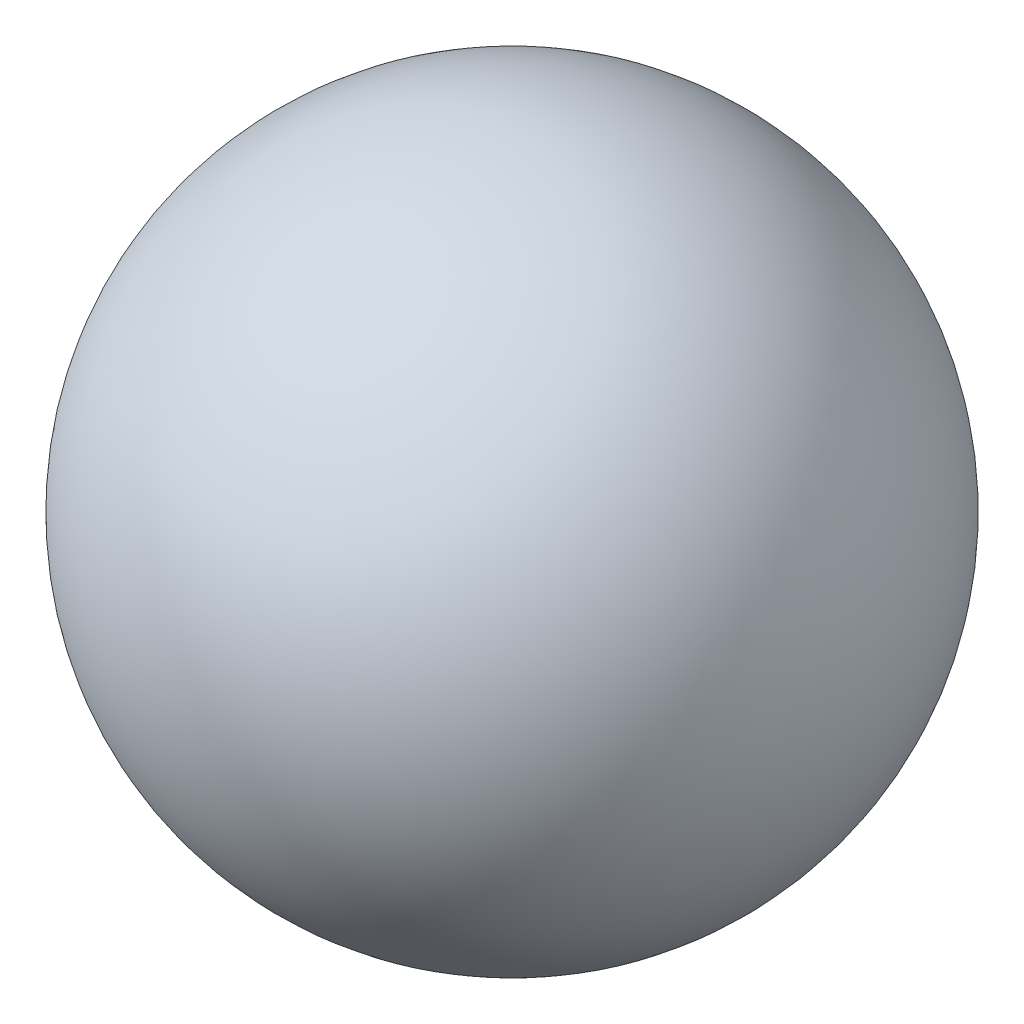
from build123d import *


with BuildPart() as part:
    # Sketch1 → Revolve1 (revolve)
    with BuildSketch(Plane.XY):
        with BuildLine():
            Line((0, 215.9), (0, 0))
            ThreePointArc((0, 0), (107.95, 107.95), (0, 215.9))
        make_face()
    revolve(axis=Axis((0, 215.9, 0), (0, -1, 0)))


solid = part.part
